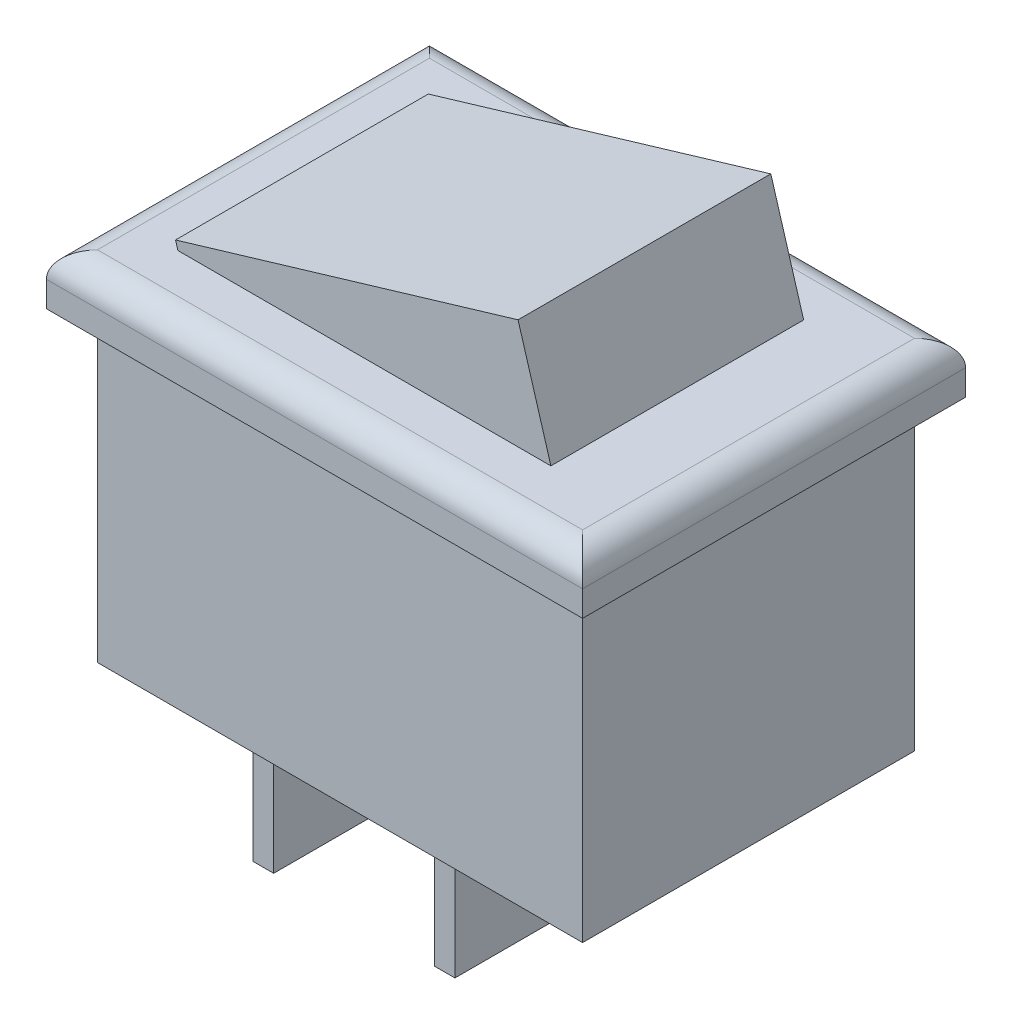
from build123d import *

# Parameters (mm, degrees)
ESQUISSE1_W          = 21
ESQUISSE1_H          = 15
BOSS_EXTRU_1_DEPTH   = 2
ESQUISSE2_W          = 19
ESQUISSE2_H          = 13
BOSS_EXTRU_2_DEPTH   = 14
ESQUISSE3_W          = 0.8
ESQUISSE3_H          = 4.8
BOSS_EXTRU_3_DEPTH   = 7.8
BOSS_EXTRU_3_2_DEPTH = 7.8
CONG_1_R             = 1
BOSS_EXTRU_4_DEPTH   = 4.95


with BuildPart() as part:
    # Esquisse1 → Boss.-Extru.1 (new body)
    with BuildSketch(Plane(origin=(0, 0, 0), x_dir=(1, 0, 0), z_dir=(0, 1, 0))):
        Rectangle(ESQUISSE1_W, ESQUISSE1_H)
    extrude(amount=BOSS_EXTRU_1_DEPTH)

    # Esquisse2 → Boss.-Extru.2 (add)
    with BuildSketch(Plane(origin=(0, 2, 0), x_dir=(1, 0, 0), z_dir=(0, 1, 0))):
        Rectangle(ESQUISSE2_W, ESQUISSE2_H)
    extrude(amount=-BOSS_EXTRU_2_DEPTH)

    # Congé1
    cong_1_edges = [part.edges().sort_by_distance(p)[0] for p in [
        (-10.5, 2, 0),
        (0, 2, 7.5),
        (10.5, 2, 0),
        (0, 2, -7.5),
    ]]
    fillet(cong_1_edges, radius=CONG_1_R)

    # Esquisse4 → Boss.-Extru.4 (add, symmetric)
    with BuildSketch(Plane.XY):
        Polygon((-7.993918218, 2.312416814), (-6.708203932, -2), (6.708203932, 2), (5.422489647, 6.312416814), align=None)
    extrude(amount=BOSS_EXTRU_4_DEPTH, both=True)


with BuildPart() as body_2:
    # Esquisse3 → Boss.-Extru.3 (new body)
    with BuildSketch(Plane.XZ.offset(12)):
        with Locations((-7.1, 0)):
            Rectangle(ESQUISSE3_W, ESQUISSE3_H)
    extrude(amount=BOSS_EXTRU_3_DEPTH)


with BuildPart() as body_3:
    # Esquisse3 → Boss.-Extru.3 2 (new body)
    with BuildSketch(Plane.XZ.offset(12)):
        Rectangle(ESQUISSE3_W, ESQUISSE3_H)
    extrude(amount=BOSS_EXTRU_3_2_DEPTH)


solid = Compound([part.part, body_2.part, body_3.part])
